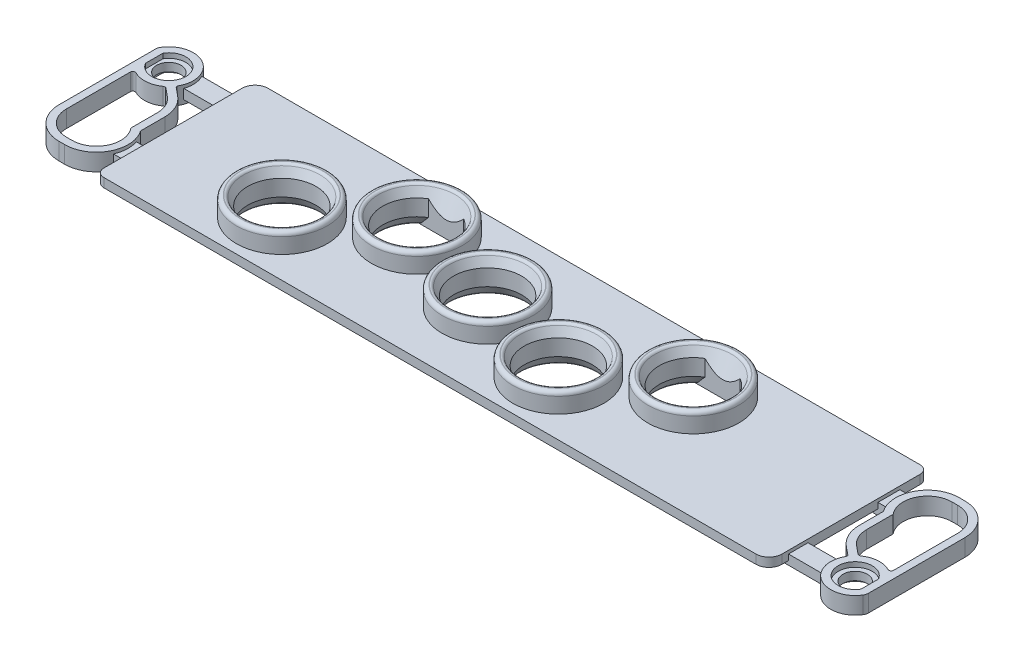
from build123d import *

# Parameters (mm, degrees)
BOSS_EXTRUDE1_DEPTH      = 0.55
BOSS_EXTRUDE2_DEPTH      = 3.95
BOSS_EXTRUDE2_DEPTH_BACK = 3.95
BOSS_EXTRUDE3_DEPTH      = 3.95
BOSS_EXTRUDE3_DEPTH_BACK = 3.95
SKETCH5_W                = 1.39
SKETCH5_H                = 0.7
BOSS_EXTRUDE4_DEPTH      = 1.35
SKETCH6_W                = 2.954
SKETCH6_H                = 0.6
BOSS_EXTRUDE5_DEPTH      = 1.2
BOSS_EXTRUDE6_DEPTH      = 1.05
SKETCH8_W                = 2.954
SKETCH8_H                = 0.6
BOSS_EXTRUDE7_DEPTH      = 1.2
SKETCH9_W                = 1.39
SKETCH9_H                = 0.7
BOSS_EXTRUDE8_DEPTH      = 1.35
BOSS_EXTRUDE9_DEPTH      = 1.05
SKETCH11_W               = 0.35
SKETCH11_H               = 0.5
SKETCH12_W               = 0.35
SKETCH12_H               = 0.5
BOSS_EXTRUDE10_DEPTH     = 2.05
BOSS_EXTRUDE11_DEPTH     = 2.05
BOSS_EXTRUDE12_DEPTH     = 2.05
BOSS_EXTRUDE13_DEPTH     = 2.05


with BuildPart() as part:
    # Sketch1 → Boss-Extrude1 (new body)
    with BuildSketch(Plane(origin=(0, 0, 0), x_dir=(1, 0, 0), z_dir=(0, 1, 0))):
        with BuildLine():
            Line((-18.7, -4.9), (21.4, -4.9))
            ThreePointArc((21.4, -4.9), (21.965685425, -4.665685425), (22.2, -4.1))
            Line((22.2, -4.1), (22.2, 4.4))
            ThreePointArc((22.2, 4.4), (22.053553391, 4.753553391), (21.7, 4.9))
            Line((21.7, 4.9), (-18.4, 4.9))
            ThreePointArc((-18.4, 4.9), (-18.965685425, 4.665685425), (-19.2, 4.1))
            Line((-19.2, 4.1), (-19.2, -4.4))
            ThreePointArc((-19.2, -4.4), (-19.053553391, -4.753553391), (-18.7, -4.9))
        make_face()
    extrude(amount=BOSS_EXTRUDE1_DEPTH)

    # Sketch2 → Boss-Extrude2 (add, two sides: drawn at the far end of the back side and taken through both)
    with BuildSketch(Plane.XY.offset(-BOSS_EXTRUDE2_DEPTH_BACK)):
        with BuildLine():
            Line((20.349, 0), (20.911132034, -0.562132034))
            ThreePointArc((20.911132034, -0.562132034), (21.008459039, -0.62716386), (21.123264069, -0.65))
            Line((21.123264069, -0.65), (21.25, -0.65))
            ThreePointArc((21.25, -0.65), (21.391421356, -0.591421356), (21.45, -0.45))
            Line((21.45, -0.45), (21.45, 0))
            Line((21.45, 0), (20.349, 0))
        make_face()
    extrude(amount=BOSS_EXTRUDE2_DEPTH + BOSS_EXTRUDE2_DEPTH_BACK)

    # Sketch3 → Boss-Extrude3 (add, two sides: drawn at the far end of the back side and taken through both)
    with BuildSketch(Plane.XY.offset(-BOSS_EXTRUDE3_DEPTH_BACK)):
        with BuildLine():
            Line((-18.25, -0.65), (-18.123264069, -0.65))
            ThreePointArc((-18.123264069, -0.65), (-18.008459039, -0.62716386), (-17.911132034, -0.562132034))
            Line((-17.911132034, -0.562132034), (-17.349, 0))
            Line((-17.349, 0), (-18.45, 0))
            Line((-18.45, 0), (-18.45, -0.45))
            ThreePointArc((-18.45, -0.45), (-18.391421356, -0.591421356), (-18.25, -0.65))
        make_face()
    extrude(amount=BOSS_EXTRUDE3_DEPTH + BOSS_EXTRUDE3_DEPTH_BACK)

    # Sketch4 → Revolve1 (revolve)
    with BuildSketch(Plane.XY, mode=Mode.PRIVATE) as revolve1_sk:
        Polygon((17.2, 0), (19.019892917, 0), (18.125, -1.55), (17.2, -1.55), align=None)
    revolve(revolve1_sk.sketch.rotate(Axis((17.2, -1.55, 0), (0, 1, 0)), 270), axis=Axis((17.2, -1.55, 0), (0, 1, 0)))

    # Sketch5 → Boss-Extrude4 (add)
    with BuildSketch(Plane.XY.offset(3.15)):
        with Locations((-19.145, 0)):
            Rectangle(SKETCH5_W, SKETCH5_H)
    extrude(amount=-BOSS_EXTRUDE4_DEPTH)

    # Sketch6 → Boss-Extrude5 (add)
    with BuildSketch(Plane.XY.offset(-3.7)):
        with Locations((-19.927, 0.05)):
            Rectangle(SKETCH6_W, SKETCH6_H)
    extrude(amount=BOSS_EXTRUDE5_DEPTH)

    # Sketch7 → Boss-Extrude6 (add)
    with BuildSketch(Plane(origin=(0, -0.5, 0), x_dir=(1, 0, 0), z_dir=(0, 1, 0))):
        with BuildLine():
            Line((-23.95, 3.526782688), (-23.95, -2.4))
            ThreePointArc((-23.95, -2.4), (-23.378858223, -3.778858223), (-22, -4.35))
            Line((-22, -4.35), (-21.65, -4.35))
            ThreePointArc((-21.65, -4.35), (-19.921399997, -3.302464421), (-20.05, -1.28532516))
            Line((-20.05, -1.28532516), (-20.05, 0.2))
            ThreePointArc((-20.05, 0.2), (-20.237354382, 1.034014644), (-20.763415822, 1.707766418))
            Line((-20.763415822, 1.707766418), (-21.275414573, 2.127678645))
            ThreePointArc((-21.275414573, 2.127678645), (-21.309419362, 2.182428602), (-21.302957283, 2.246554455))
            ThreePointArc((-21.302957283, 2.246554455), (-21.828111524, 4.286152472), (-23.875, 3.790174031))
            ThreePointArc((-23.875, 3.790174031), (-23.930884602, 3.663713327), (-23.95, 3.526782688))
        make_face()
        with BuildLine():
            Line((-23.5, 1.530306154), (-23.5, -2.4))
            ThreePointArc((-23.5, -2.4), (-23.060660172, -3.460660172), (-22, -3.9))
            Line((-22, -3.9), (-21.65, -3.9))
            ThreePointArc((-21.65, -3.9), (-20.290845479, -3.034585683), (-20.5, -1.436931986))
            Line((-20.5, -1.436931986), (-20.5, 0.2))
            ThreePointArc((-20.5, 0.2), (-20.644118756, 0.841549726), (-21.048781402, 1.359820321))
            Line((-21.048781402, 1.359820321), (-21.549650541, 1.770604675))
            ThreePointArc((-21.549650541, 1.770604675), (-21.639561511, 1.804532104), (-21.731611273, 1.776929675))
            ThreePointArc((-21.731611273, 1.776929675), (-22.490934703, 1.503970334), (-23.281818182, 1.663914686))
            ThreePointArc((-23.281818182, 1.663914686), (-23.428334945, 1.658226584), (-23.5, 1.530306154))
        make_face(mode=Mode.SUBTRACT)
        with BuildLine():
            Line((-23.5, 3.540832691), (-23.5, 2.459167309))
            ThreePointArc((-23.5, 2.459167309), (-21.55, 3), (-23.5, 3.540832691))
        make_face(mode=Mode.SUBTRACT)
    extrude(amount=BOSS_EXTRUDE6_DEPTH)

    # Sketch8 → Boss-Extrude7 (add)
    with BuildSketch(Plane.XY.offset(3.7)):
        with Locations((22.927, 0.05)):
            Rectangle(SKETCH8_W, SKETCH8_H)
    extrude(amount=-BOSS_EXTRUDE7_DEPTH)

    # Sketch9 → Boss-Extrude8 (add)
    with BuildSketch(Plane.XY.offset(-3.15)):
        with Locations((22.145, 0)):
            Rectangle(SKETCH9_W, SKETCH9_H)
    extrude(amount=BOSS_EXTRUDE8_DEPTH)

    # Sketch10 → Boss-Extrude9 (add)
    with BuildSketch(Plane(origin=(0, -0.5, 0), x_dir=(1, 0, 0), z_dir=(0, 1, 0))):
        with BuildLine():
            Line((23.05, 1.28532516), (23.05, -0.2))
            ThreePointArc((23.05, -0.2), (23.237354382, -1.034014644), (23.763415822, -1.707766418))
            Line((23.763415822, -1.707766418), (24.275414573, -2.127678645))
            ThreePointArc((24.275414573, -2.127678645), (24.309419362, -2.182428602), (24.302957283, -2.246554455))
            ThreePointArc((24.302957283, -2.246554455), (24.828111524, -4.286152472), (26.875, -3.790174031))
            ThreePointArc((26.875, -3.790174031), (26.930884602, -3.663713327), (26.95, -3.526782688))
            Line((26.95, -3.526782688), (26.95, 2.4))
            ThreePointArc((26.95, 2.4), (26.378858223, 3.778858223), (25, 4.35))
            Line((25, 4.35), (24.65, 4.35))
            ThreePointArc((24.65, 4.35), (22.921399997, 3.302464421), (23.05, 1.28532516))
        make_face()
        with BuildLine():
            Line((26.5, -3.540832691), (26.5, -2.459167309))
            ThreePointArc((26.5, -2.459167309), (24.55, -3), (26.5, -3.540832691))
        make_face(mode=Mode.SUBTRACT)
        with BuildLine():
            Line((23.5, 1.436931986), (23.5, -0.2))
            ThreePointArc((23.5, -0.2), (23.644118756, -0.841549726), (24.048781402, -1.359820321))
            Line((24.048781402, -1.359820321), (24.549650541, -1.770604675))
            ThreePointArc((24.549650541, -1.770604675), (24.639561511, -1.804532104), (24.731611273, -1.776929675))
            ThreePointArc((24.731611273, -1.776929675), (25.490934714, -1.503970333), (26.281818201, -1.663914695))
            ThreePointArc((26.281818201, -1.663914695), (26.428334954, -1.658226579), (26.5, -1.530306154))
            Line((26.5, -1.530306154), (26.5, 2.4))
            ThreePointArc((26.5, 2.4), (26.060660172, 3.460660172), (25, 3.9))
            Line((25, 3.9), (24.65, 3.9))
            ThreePointArc((24.65, 3.9), (23.290845479, 3.034585683), (23.5, 1.436931986))
        make_face(mode=Mode.SUBTRACT)
    extrude(amount=BOSS_EXTRUDE9_DEPTH)

    # Sketch11 → Revolve2 (revolve)
    with BuildSketch(Plane.XY.offset(-3), mode=Mode.PRIVATE) as revolve2_sk:
        with Locations((-23.525, 0)):
            Rectangle(SKETCH11_W, SKETCH11_H)
    revolve(revolve2_sk.sketch.rotate(Axis((-22.6, 0.25, -3), (0, -1, 0)), 90), axis=Axis((-22.6, 0.25, -3), (0, -1, 0)))

    # Sketch12 → Revolve3 (revolve)
    with BuildSketch(Plane.XY.offset(3), mode=Mode.PRIVATE) as revolve3_sk:
        with Locations((24.675, 0)):
            Rectangle(SKETCH12_W, SKETCH12_H)
    revolve(revolve3_sk.sketch.rotate(Axis((25.6, 0.25, 3), (0, -1, 0)), 90), axis=Axis((25.6, 0.25, 3), (0, -1, 0)))

    # Sketch13 → Revolve4 (revolve)
    with BuildSketch(Plane.XY, mode=Mode.PRIVATE) as revolve4_sk:
        with BuildLine():
            Line((0, 1.75), (2.55, 1.75))
            ThreePointArc((2.55, 1.75), (2.726776695, 1.676776695), (2.8, 1.5))
            Line((2.8, 1.5), (2.8, 0))
            Line((2.8, 0), (2.9, 0))
            Line((2.9, 0), (2.772136157, -0.351303021))
            ThreePointArc((2.772136157, -0.351303021), (2.717218729, -0.422872807), (2.631182264, -0.45))
            Line((2.631182264, -0.45), (0, -0.45))
            Line((0, -0.45), (0, 1.75))
        make_face()
    revolve(revolve4_sk.sketch.rotate(Axis((0, -0.45, 0), (0, 1, 0)), 270), axis=Axis((0, -0.45, 0), (0, 1, 0)))

    # Sketch14 → Revolve5 (revolve)
    with BuildSketch(Plane.XY.offset(1.55), mode=Mode.PRIVATE) as revolve5_sk:
        with BuildLine():
            Line((5.9, 1.75), (8.45, 1.75))
            ThreePointArc((8.45, 1.75), (8.626776695, 1.676776695), (8.7, 1.5))
            Line((8.7, 1.5), (8.7, 0))
            Line((8.7, 0), (8.8, 0))
            Line((8.8, 0), (8.672136157, -0.351303021))
            ThreePointArc((8.672136157, -0.351303021), (8.617218729, -0.422872807), (8.531182264, -0.45))
            Line((8.531182264, -0.45), (5.9, -0.45))
            Line((5.9, -0.45), (5.9, 1.75))
        make_face()
    revolve(revolve5_sk.sketch.rotate(Axis((5.9, -0.45, 1.55), (0, 1, 0)), 270), axis=Axis((5.9, -0.45, 1.55), (0, 1, 0)))

    # Sketch15 → Revolve6 (revolve)
    with BuildSketch(Plane.XY.offset(1.55), mode=Mode.PRIVATE) as revolve6_sk:
        with BuildLine():
            Line((-11.1, 1.75), (-8.55, 1.75))
            ThreePointArc((-8.55, 1.75), (-8.373223305, 1.676776695), (-8.3, 1.5))
            Line((-8.3, 1.5), (-8.3, 0))
            Line((-8.3, 0), (-8.2, 0))
            Line((-8.2, 0), (-8.327863843, -0.351303021))
            ThreePointArc((-8.327863843, -0.351303021), (-8.382781271, -0.422872807), (-8.468817736, -0.45))
            Line((-8.468817736, -0.45), (-11.1, -0.45))
            Line((-11.1, -0.45), (-11.1, 1.75))
        make_face()
    revolve(revolve6_sk.sketch.rotate(Axis((-11.1, -0.45, 1.55), (0, 1, 0)), 270), axis=Axis((-11.1, -0.45, 1.55), (0, 1, 0)))

    # Sketch16 → Revolve7 (revolve)
    with BuildSketch(Plane.XY.offset(-1.55), mode=Mode.PRIVATE) as revolve7_sk:
        with BuildLine():
            Line((11.1, 1.75), (13.65, 1.75))
            ThreePointArc((13.65, 1.75), (13.826776695, 1.676776695), (13.9, 1.5))
            Line((13.9, 1.5), (13.9, 0))
            Line((13.9, 0), (14, 0))
            Line((14, 0), (13.872136157, -0.351303021))
            ThreePointArc((13.872136157, -0.351303021), (13.817218729, -0.422872807), (13.731182264, -0.45))
            Line((13.731182264, -0.45), (11.1, -0.45))
            Line((11.1, -0.45), (11.1, 1.75))
        make_face()
    revolve(revolve7_sk.sketch.rotate(Axis((11.1, -0.45, -1.55), (0, 1, 0)), 270), axis=Axis((11.1, -0.45, -1.55), (0, 1, 0)))

    # Sketch17 → Revolve8 (revolve)
    with BuildSketch(Plane.XY.offset(-1.55), mode=Mode.PRIVATE) as revolve8_sk:
        with BuildLine():
            Line((-5.9, 1.75), (-3.35, 1.75))
            ThreePointArc((-3.35, 1.75), (-3.173223305, 1.676776695), (-3.1, 1.5))
            Line((-3.1, 1.5), (-3.1, 0))
            Line((-3.1, 0), (-3, 0))
            Line((-3, 0), (-3.127863843, -0.351303021))
            ThreePointArc((-3.127863843, -0.351303021), (-3.182781271, -0.422872807), (-3.268817736, -0.45))
            Line((-3.268817736, -0.45), (-5.9, -0.45))
            Line((-5.9, -0.45), (-5.9, 1.75))
        make_face()
    revolve(revolve8_sk.sketch.rotate(Axis((-5.9, -0.45, -1.55), (0, 1, 0)), 270), axis=Axis((-5.9, -0.45, -1.55), (0, 1, 0)))

    # Sketch18 → Cut-Revolve1 (revolve, cut)
    with BuildSketch(Plane.XY, mode=Mode.PRIVATE) as cut_revolve1_sk:
        with BuildLine():
            Line((0, 1.75), (2.528275427, 1.75))
            ThreePointArc((2.528275427, 1.75), (2.423775714, 1.720528033), (2.350074122, 1.6407981))
            Line((2.350074122, 1.6407981), (2.1, 1.15))
            Line((2.1, 1.15), (2.1, 0.15))
            Line((2.1, 0.15), (2.336163836, -0.313497625))
            ThreePointArc((2.336163836, -0.313497625), (2.428290826, -0.413160041), (2.558915467, -0.45))
            Line((2.558915467, -0.45), (0, -0.45))
            Line((0, -0.45), (0, 1.75))
        make_face()
    revolve(cut_revolve1_sk.sketch.rotate(Axis((0, -0.45, 0), (0, 1, 0)), 270), axis=Axis((0, -0.45, 0), (0, 1, 0)), mode=Mode.SUBTRACT)

    # Sketch19 → Cut-Revolve2 (revolve, cut)
    with BuildSketch(Plane.XY.offset(1.55), mode=Mode.PRIVATE) as cut_revolve2_sk:
        with BuildLine():
            Line((5.9, 1.75), (8.428275427, 1.75))
            ThreePointArc((8.428275427, 1.75), (8.323775714, 1.720528033), (8.250074122, 1.6407981))
            Line((8.250074122, 1.6407981), (8, 1.15))
            Line((8, 1.15), (8, 0.15))
            Line((8, 0.15), (8.236163836, -0.313497625))
            ThreePointArc((8.236163836, -0.313497625), (8.328290826, -0.413160041), (8.458915467, -0.45))
            Line((8.458915467, -0.45), (5.9, -0.45))
            Line((5.9, -0.45), (5.9, 1.75))
        make_face()
    revolve(cut_revolve2_sk.sketch.rotate(Axis((5.9, -0.45, 1.55), (0, 1, 0)), 270), axis=Axis((5.9, -0.45, 1.55), (0, 1, 0)), mode=Mode.SUBTRACT)

    # Sketch20 → Cut-Revolve3 (revolve, cut)
    with BuildSketch(Plane.XY.offset(1.55), mode=Mode.PRIVATE) as cut_revolve3_sk:
        with BuildLine():
            Line((-11.1, 1.75), (-8.571724573, 1.75))
            ThreePointArc((-8.571724573, 1.75), (-8.676224286, 1.720528033), (-8.749925878, 1.6407981))
            Line((-8.749925878, 1.6407981), (-9, 1.15))
            Line((-9, 1.15), (-9, 0.15))
            Line((-9, 0.15), (-8.763836164, -0.313497625))
            ThreePointArc((-8.763836164, -0.313497625), (-8.671709174, -0.413160041), (-8.541084533, -0.45))
            Line((-8.541084533, -0.45), (-11.1, -0.45))
            Line((-11.1, -0.45), (-11.1, 1.75))
        make_face()
    revolve(cut_revolve3_sk.sketch.rotate(Axis((-11.1, -0.45, 1.55), (0, 1, 0)), 270), axis=Axis((-11.1, -0.45, 1.55), (0, 1, 0)), mode=Mode.SUBTRACT)

    # Sketch21 → Cut-Revolve4 (revolve, cut)
    with BuildSketch(Plane.XY.offset(-1.55), mode=Mode.PRIVATE) as cut_revolve4_sk:
        with BuildLine():
            Line((11.1, 1.75), (13.628275427, 1.75))
            ThreePointArc((13.628275427, 1.75), (13.523775714, 1.720528033), (13.450074122, 1.6407981))
            Line((13.450074122, 1.6407981), (13.2, 1.15))
            Line((13.2, 1.15), (13.2, 0.15))
            Line((13.2, 0.15), (13.436163836, -0.313497625))
            ThreePointArc((13.436163836, -0.313497625), (13.528290826, -0.413160041), (13.658915467, -0.45))
            Line((13.658915467, -0.45), (11.1, -0.45))
            Line((11.1, -0.45), (11.1, 1.75))
        make_face()
    revolve(cut_revolve4_sk.sketch.rotate(Axis((11.1, -0.45, -1.55), (0, 1, 0)), 270), axis=Axis((11.1, -0.45, -1.55), (0, 1, 0)), mode=Mode.SUBTRACT)

    # Sketch22 → Cut-Revolve5 (revolve, cut)
    with BuildSketch(Plane.XY.offset(-1.55), mode=Mode.PRIVATE) as cut_revolve5_sk:
        with BuildLine():
            Line((-5.9, 1.75), (-3.371724573, 1.75))
            ThreePointArc((-3.371724573, 1.75), (-3.476224286, 1.720528033), (-3.549925878, 1.6407981))
            Line((-3.549925878, 1.6407981), (-3.8, 1.15))
            Line((-3.8, 1.15), (-3.8, 0.15))
            Line((-3.8, 0.15), (-3.563836164, -0.313497625))
            ThreePointArc((-3.563836164, -0.313497625), (-3.471709174, -0.413160041), (-3.341084533, -0.45))
            Line((-3.341084533, -0.45), (-5.9, -0.45))
            Line((-5.9, -0.45), (-5.9, 1.75))
        make_face()
    revolve(cut_revolve5_sk.sketch.rotate(Axis((-5.9, -0.45, -1.55), (0, 1, 0)), 270), axis=Axis((-5.9, -0.45, -1.55), (0, 1, 0)), mode=Mode.SUBTRACT)

    # Sketch23 → Boss-Extrude10 (add)
    with BuildSketch(Plane(origin=(0, -0.45, 0), x_dir=(1, 0, 0), z_dir=(0, 1, 0))):
        with BuildLine():
            Line((-7.776166304, 3.35), (-4.023833696, 3.35))
            ThreePointArc((-4.023833696, 3.35), (-5.9, 4.15), (-7.776166304, 3.35))
        make_face()
    extrude(amount=BOSS_EXTRUDE10_DEPTH)

    # Sketch24 → Cut-Revolve6 (revolve, cut)
    with BuildSketch(Plane.XY.offset(-1.55)):
        with BuildLine():
            Line((-5.9, 1.75), (-3.371724573, 1.75))
            ThreePointArc((-3.371724573, 1.75), (-3.476224286, 1.720528033), (-3.549925878, 1.6407981))
            Line((-3.549925878, 1.6407981), (-4.564288174, -0.35))
            Line((-4.564288174, -0.35), (-5.9, -0.35))
            Line((-5.9, -0.35), (-5.9, 1.75))
        make_face()
    revolve(axis=Axis((-5.9, -0.45, -1.55), (0, 1, 0)), mode=Mode.SUBTRACT)

    # Sketch25 → Boss-Extrude11 (add)
    with BuildSketch(Plane(origin=(0, -0.45, 0), x_dir=(1, 0, 0), z_dir=(0, 1, 0))):
        with BuildLine():
            Line((9.223833696, 3.35), (12.976166304, 3.35))
            ThreePointArc((12.976166304, 3.35), (11.1, 4.15), (9.223833696, 3.35))
        make_face()
    extrude(amount=BOSS_EXTRUDE11_DEPTH)

    # Sketch26 → Cut-Revolve7 (revolve, cut)
    with BuildSketch(Plane.XY.offset(-1.55)):
        with BuildLine():
            Line((11.1, 1.75), (13.628275427, 1.75))
            ThreePointArc((13.628275427, 1.75), (13.523775714, 1.720528033), (13.450074122, 1.6407981))
            Line((13.450074122, 1.6407981), (12.435711826, -0.35))
            Line((12.435711826, -0.35), (11.1, -0.35))
            Line((11.1, -0.35), (11.1, 1.75))
        make_face()
    revolve(axis=Axis((11.1, -0.45, -1.55), (0, 1, 0)), mode=Mode.SUBTRACT)

    # Sketch27 → Boss-Extrude12 (add)
    with BuildSketch(Plane(origin=(0, -0.45, 0), x_dir=(1, 0, 0), z_dir=(0, 1, 0))):
        with BuildLine():
            Line((7.776166304, -3.35), (4.023833696, -3.35))
            ThreePointArc((4.023833696, -3.35), (5.9, -4.15), (7.776166304, -3.35))
        make_face()
    extrude(amount=BOSS_EXTRUDE12_DEPTH)

    # Sketch28 → Cut-Revolve8 (revolve, cut)
    with BuildSketch(Plane.XY.offset(1.55), mode=Mode.PRIVATE) as cut_revolve8_sk:
        with BuildLine():
            Line((5.9, 1.75), (8.428275427, 1.75))
            ThreePointArc((8.428275427, 1.75), (8.323775714, 1.720528033), (8.250074122, 1.6407981))
            Line((8.250074122, 1.6407981), (7.235711826, -0.35))
            Line((7.235711826, -0.35), (5.9, -0.35))
            Line((5.9, -0.35), (5.9, 1.75))
        make_face()
    revolve(cut_revolve8_sk.sketch.rotate(Axis((5.9, -0.45, 1.55), (0, 1, 0)), 270), axis=Axis((5.9, -0.45, 1.55), (0, 1, 0)), mode=Mode.SUBTRACT)

    # Sketch29 → Boss-Extrude13 (add)
    with BuildSketch(Plane(origin=(0, -0.45, 0), x_dir=(1, 0, 0), z_dir=(0, 1, 0))):
        with BuildLine():
            Line((-9.223833696, -3.35), (-12.976166304, -3.35))
            ThreePointArc((-12.976166304, -3.35), (-11.1, -4.15), (-9.223833696, -3.35))
        make_face()
    extrude(amount=BOSS_EXTRUDE13_DEPTH)

    # Sketch30 → Cut-Revolve9 (revolve, cut)
    with BuildSketch(Plane.XY.offset(1.55), mode=Mode.PRIVATE) as cut_revolve9_sk:
        with BuildLine():
            Line((-11.1, 1.75), (-8.571724573, 1.75))
            ThreePointArc((-8.571724573, 1.75), (-8.676224286, 1.720528033), (-8.749925878, 1.6407981))
            Line((-8.749925878, 1.6407981), (-9.764288174, -0.35))
            Line((-9.764288174, -0.35), (-11.1, -0.35))
            Line((-11.1, -0.35), (-11.1, 1.75))
        make_face()
    revolve(cut_revolve9_sk.sketch.rotate(Axis((-11.1, -0.45, 1.55), (0, 1, 0)), 270), axis=Axis((-11.1, -0.45, 1.55), (0, 1, 0)), mode=Mode.SUBTRACT)


solid = part.part
